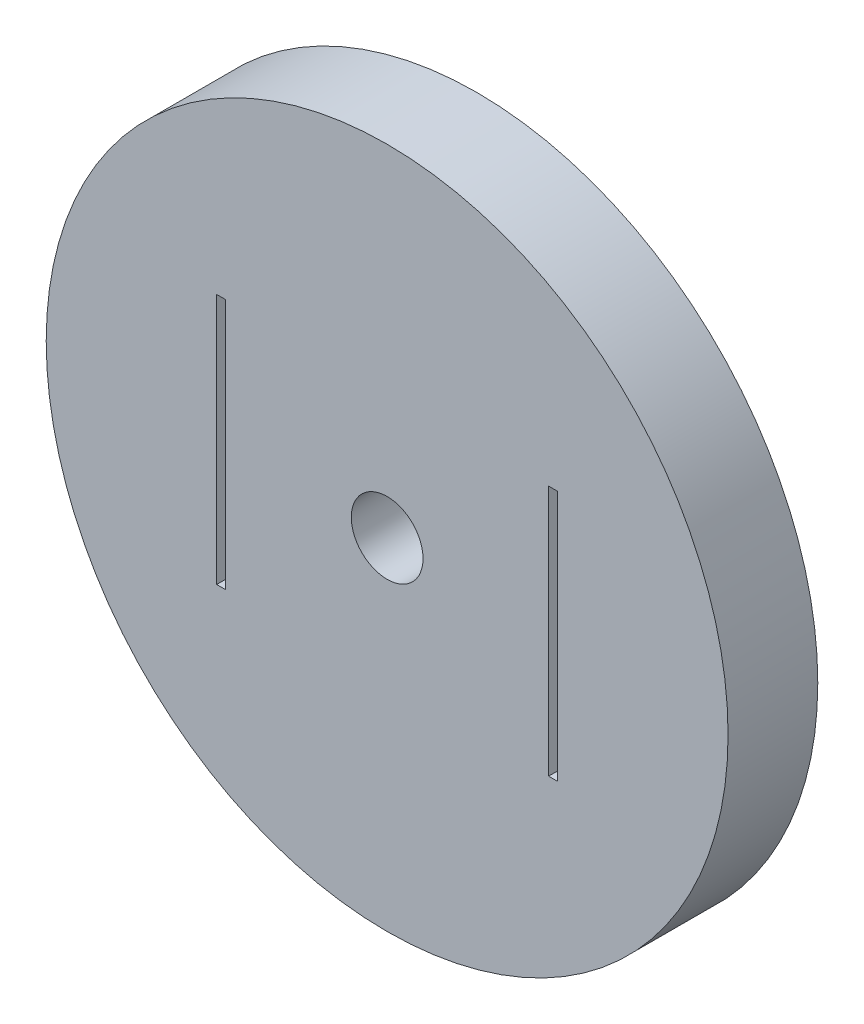
from build123d import *

# Parameters (mm, degrees)
SKETCH1_R           = 19
SKETCH1_R_2         = 2
SKETCH1_W           = 0.5
SKETCH1_H           = 14
BOSS_EXTRUDE1_DEPTH = 5


with BuildPart() as part:
    # Sketch1 → Boss-Extrude1 (new body)
    with BuildSketch(Plane.XY):
        Circle(SKETCH1_R)
        Circle(SKETCH1_R_2, mode=Mode.SUBTRACT)
        with Locations((-9.25, 0)):
            Rectangle(SKETCH1_W, SKETCH1_H, mode=Mode.SUBTRACT)
        with Locations((9.25, 0)):
            Rectangle(SKETCH1_W, SKETCH1_H, mode=Mode.SUBTRACT)
    extrude(amount=BOSS_EXTRUDE1_DEPTH)

    # Sketch3 → Revolve1 (revolve)
    with BuildSketch(Plane(origin=(0, 0, 0), x_dir=(1, 0, 0), z_dir=(0, 1, 0))):
        with BuildLine():
            Line((-16.5, 6.5), (-16.5, 0))
            Line((-16.5, 0), (-14.5, 0))
            Line((-14.5, 0), (-14.5, 8.5))
            ThreePointArc((-14.5, 8.5), (-15.914213562, 7.914213562), (-16.5, 6.5))
        make_face()
    revolve(axis=Axis((-14.5, 0, -6.5), (0, 0, 1)))


solid = part.part
